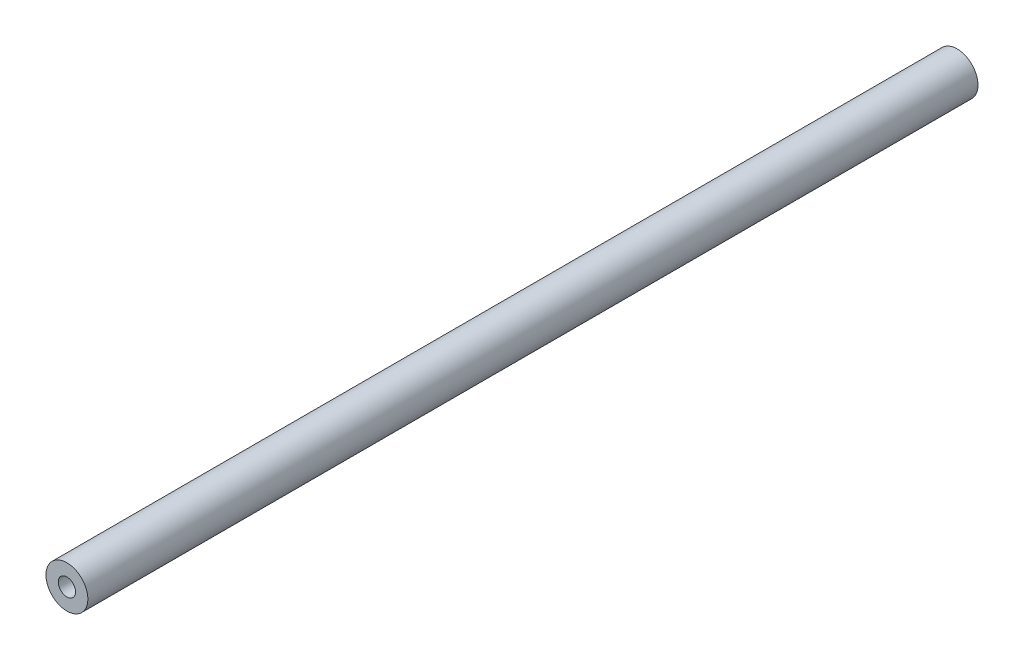
from build123d import *

# Parameters (mm, degrees)
SKETCH_1_R             = 4
EXTRUDE_1_DEPTH        = 170
HOLE_WIZARD_M4_2_D     = 3.3
HOLE_WIZARD_M4_2_DEPTH = 15.5
HOLE_WIZARD_M4_2_TIP   = 0.991420021


with BuildPart() as part:
    # 草图1 → 凸台-拉伸1 (new body)
    with BuildSketch(Plane.XY):
        Circle(SKETCH_1_R)
    extrude(amount=EXTRUDE_1_DEPTH)

    # 草图5 → M4 螺纹孔1 (revolve, cut)
    with BuildSketch(Plane(origin=(0, 0, 170), x_dir=(0, -1, 0), z_dir=(1, 0, 0))):
        Polygon((0, 0), (0, 16.491420021), (1.65, 15.5), (1.65, 0), align=None)
    revolve(axis=Axis((0, 0, 176.35), (0, 0, -1)), mode=Mode.SUBTRACT)

    # M4 螺纹孔2
    with Locations(Plane(origin=(0, 0, 0), x_dir=(-1, 0, 0), z_dir=(0, 0, -1))):
        with Locations((0, 0)):
            Hole(HOLE_WIZARD_M4_2_D / 2, depth=HOLE_WIZARD_M4_2_DEPTH)
            with Locations((0, 0, -(HOLE_WIZARD_M4_2_DEPTH + HOLE_WIZARD_M4_2_TIP / 2))):  # 118° drill point
                Cone(0, HOLE_WIZARD_M4_2_D / 2, HOLE_WIZARD_M4_2_TIP, mode=Mode.SUBTRACT)


solid = part.part
